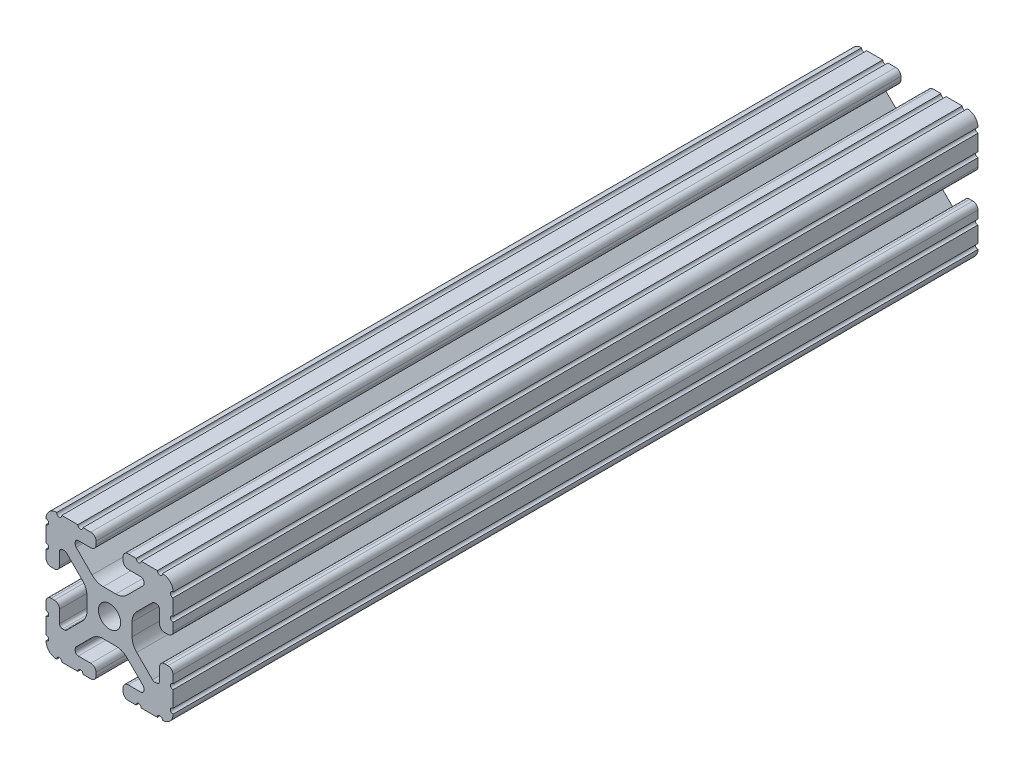
from build123d import *

# Parameters (mm, degrees)
SKETCH1_R      = 3.3274
EXTRUDE1_DEPTH = 241.3


with BuildPart() as part:
    # Sketch1 → Extrude1 (new body)
    with BuildSketch(Plane.XY):
        with BuildLine():
            Line((-10.022898969, 12.91475973), (-5.252158105, 8.144007132))
            ThreePointArc((-5.252158105, 8.144007132), (-3.715177372, 7.117027388), (-1.902183975, 6.7564))
            Line((-1.902183975, 6.7564), (1.902183975, 6.7564))
            ThreePointArc((1.902183975, 6.7564), (3.715177372, 7.117027388), (5.252158105, 8.144007132))
            Line((5.252158105, 8.144007132), (10.022898969, 12.91475973))
            ThreePointArc((10.022898969, 12.91475973), (10.218362387, 13.207291992), (10.287, 13.552357131))
            Line((10.287, 13.552357131), (10.287, 14.0843))
            ThreePointArc((10.287, 14.0843), (10.022898185, 14.721898185), (9.3853, 14.986))
            Line((9.3853, 14.986), (5.617617549, 14.986))
            ThreePointArc((5.617617549, 14.986), (4.519044045, 15.441044045), (4.064, 16.539617549))
            Line((4.064, 16.539617549), (4.064, 17.496382451))
            ThreePointArc((4.064, 17.496382451), (4.519044045, 18.594955955), (5.617617549, 19.05))
            Line((5.617617549, 19.05), (7.974178704, 19.05))
            ThreePointArc((7.974178704, 19.05), (8.736178704, 18.288), (9.498178704, 19.05))
            Line((9.498178704, 19.05), (14.327719207, 19.05))
            ThreePointArc((14.327719207, 19.05), (15.087603123, 18.231251131), (15.847487039, 19.05))
            ThreePointArc((15.847487039, 19.05), (18.120176289, 18.120192083), (19.05, 15.847509295))
            ThreePointArc((19.05, 15.847509295), (18.231250992, 15.08762539), (19.05, 14.327741484))
            Line((19.05, 14.327741484), (19.05, 9.496091471))
            ThreePointArc((19.05, 9.496091471), (18.231250992, 8.736207565), (19.05, 7.97632366))
            Line((19.05, 7.97632366), (19.05, 5.617617549))
            ThreePointArc((19.05, 5.617617549), (18.594955955, 4.519044045), (17.496382451, 4.064))
            Line((17.496382451, 4.064), (16.539617549, 4.064))
            ThreePointArc((16.539617549, 4.064), (15.441044045, 4.519044045), (14.986, 5.617617549))
            Line((14.986, 5.617617549), (14.986, 9.385342516))
            ThreePointArc((14.986, 9.385342516), (14.721898185, 10.022940701), (14.0843, 10.287042516))
            Line((14.0843, 10.287042516), (13.516042086, 10.287042516))
            ThreePointArc((13.516042086, 10.287042516), (13.170975923, 10.218404478), (12.878443117, 10.022939917))
            Line((12.878443117, 10.022939917), (8.14758008, 5.292065243))
            ThreePointArc((8.14758008, 5.292065243), (7.117955879, 3.751120653), (6.7564, 1.933453584))
            Line((6.7564, 1.933453584), (6.7564, -1.933453584))
            ThreePointArc((6.7564, -1.933453584), (7.117955879, -3.751120653), (8.14758008, -5.292065243))
            Line((8.14758008, -5.292065243), (12.878443117, -10.022939917))
            ThreePointArc((12.878443117, -10.022939917), (13.170975923, -10.218404478), (13.516042086, -10.287042516))
            Line((13.516042086, -10.287042516), (14.0843, -10.287042516))
            ThreePointArc((14.0843, -10.287042516), (14.721898185, -10.022940701), (14.986, -9.385342516))
            Line((14.986, -9.385342516), (14.986, -5.617617549))
            ThreePointArc((14.986, -5.617617549), (15.441044045, -4.519044045), (16.539617549, -4.064))
            Line((16.539617549, -4.064), (17.496382451, -4.064))
            ThreePointArc((17.496382451, -4.064), (18.594955955, -4.519044045), (19.05, -5.617617549))
            Line((19.05, -5.617617549), (19.05, -7.976318491))
            ThreePointArc((19.05, -7.976318491), (18.231250992, -8.736202396), (19.05, -9.496086302))
            Line((19.05, -9.496086302), (19.05, -14.32774291))
            ThreePointArc((19.05, -14.32774291), (18.231250992, -15.087626816), (19.05, -15.847510721))
            ThreePointArc((19.05, -15.847510721), (18.120175716, -18.120192644), (15.847486868, -19.05))
            ThreePointArc((15.847486868, -19.05), (15.087602952, -18.231251131), (14.327719036, -19.05))
            Line((14.327719036, -19.05), (9.496062448, -19.05))
            ThreePointArc((9.496062448, -19.05), (8.736178532, -18.231251131), (7.976294616, -19.05))
            Line((7.976294616, -19.05), (5.617617549, -19.05))
            ThreePointArc((5.617617549, -19.05), (4.519044045, -18.594955955), (4.064, -17.496382451))
            Line((4.064, -17.496382451), (4.064, -16.539617549))
            ThreePointArc((4.064, -16.539617549), (4.519044045, -15.441044045), (5.617617549, -14.986))
            Line((5.617617549, -14.986), (9.3853, -14.986))
            ThreePointArc((9.3853, -14.986), (10.022898185, -14.721898185), (10.287, -14.0843))
            Line((10.287, -14.0843), (10.287, -13.552357131))
            ThreePointArc((10.287, -13.552357131), (10.218362387, -13.207291992), (10.022898969, -12.91475973))
            Line((10.022898969, -12.91475973), (5.252158105, -8.144007132))
            ThreePointArc((5.252158105, -8.144007132), (3.715177372, -7.117027388), (1.902183975, -6.7564))
            Line((1.902183975, -6.7564), (-1.902183975, -6.7564))
            ThreePointArc((-1.902183975, -6.7564), (-3.715177372, -7.117027388), (-5.252158105, -8.144007132))
            Line((-5.252158105, -8.144007132), (-10.022898969, -12.91475973))
            ThreePointArc((-10.022898969, -12.91475973), (-10.218362387, -13.207291992), (-10.287, -13.552357131))
            Line((-10.287, -13.552357131), (-10.287, -14.0843))
            ThreePointArc((-10.287, -14.0843), (-10.022898185, -14.721898185), (-9.3853, -14.986))
            Line((-9.3853, -14.986), (-5.617617549, -14.986))
            ThreePointArc((-5.617617549, -14.986), (-4.519044045, -15.441044045), (-4.064, -16.539617549))
            Line((-4.064, -16.539617549), (-4.064, -17.496382451))
            ThreePointArc((-4.064, -17.496382451), (-4.519044045, -18.594955955), (-5.617617549, -19.05))
            Line((-5.617617549, -19.05), (-7.976294616, -19.05))
            ThreePointArc((-7.976294616, -19.05), (-8.736178532, -18.231251131), (-9.496062448, -19.05))
            Line((-9.496062448, -19.05), (-14.327719036, -19.05))
            ThreePointArc((-14.327719036, -19.05), (-15.087602952, -18.231251131), (-15.847486868, -19.05))
            ThreePointArc((-15.847486868, -19.05), (-18.120175716, -18.120192644), (-19.05, -15.847510721))
            ThreePointArc((-19.05, -15.847510721), (-18.231250992, -15.087626816), (-19.05, -14.32774291))
            Line((-19.05, -14.32774291), (-19.05, -9.496086302))
            ThreePointArc((-19.05, -9.496086302), (-18.231250992, -8.736202396), (-19.05, -7.976318491))
            Line((-19.05, -7.976318491), (-19.05, -5.617617549))
            ThreePointArc((-19.05, -5.617617549), (-18.594955955, -4.519044045), (-17.496382451, -4.064))
            Line((-17.496382451, -4.064), (-16.539617549, -4.064))
            ThreePointArc((-16.539617549, -4.064), (-15.441044045, -4.519044045), (-14.986, -5.617617549))
            Line((-14.986, -5.617617549), (-14.986, -9.385342516))
            ThreePointArc((-14.986, -9.385342516), (-14.721898185, -10.022940701), (-14.0843, -10.287042516))
            Line((-14.0843, -10.287042516), (-13.516042086, -10.287042516))
            ThreePointArc((-13.516042086, -10.287042516), (-13.170975923, -10.218404478), (-12.878443117, -10.022939917))
            Line((-12.878443117, -10.022939917), (-8.14758008, -5.292065243))
            ThreePointArc((-8.14758008, -5.292065243), (-7.117955879, -3.751120653), (-6.7564, -1.933453584))
            Line((-6.7564, -1.933453584), (-6.7564, 1.933453584))
            ThreePointArc((-6.7564, 1.933453584), (-7.117955879, 3.751120653), (-8.14758008, 5.292065243))
            Line((-8.14758008, 5.292065243), (-12.878443117, 10.022939917))
            ThreePointArc((-12.878443117, 10.022939917), (-13.170975923, 10.218404478), (-13.516042086, 10.287042516))
            Line((-13.516042086, 10.287042516), (-14.0843, 10.287042516))
            ThreePointArc((-14.0843, 10.287042516), (-14.721898185, 10.022940701), (-14.986, 9.385342516))
            Line((-14.986, 9.385342516), (-14.986, 5.617617549))
            ThreePointArc((-14.986, 5.617617549), (-15.441044045, 4.519044045), (-16.539617549, 4.064))
            Line((-16.539617549, 4.064), (-17.496382451, 4.064))
            ThreePointArc((-17.496382451, 4.064), (-18.594955955, 4.519044045), (-19.05, 5.617617549))
            Line((-19.05, 5.617617549), (-19.05, 7.97632366))
            ThreePointArc((-19.05, 7.97632366), (-18.231250992, 8.736207565), (-19.05, 9.496091471))
            Line((-19.05, 9.496091471), (-19.05, 14.327741484))
            ThreePointArc((-19.05, 14.327741484), (-18.231250992, 15.08762539), (-19.05, 15.847509295))
            ThreePointArc((-19.05, 15.847509295), (-18.120176289, 18.120192083), (-15.847487039, 19.05))
            ThreePointArc((-15.847487039, 19.05), (-15.087603123, 18.231251131), (-14.327719207, 19.05))
            Line((-14.327719207, 19.05), (-9.498178704, 19.05))
            ThreePointArc((-9.498178704, 19.05), (-8.736178704, 18.288), (-7.974178704, 19.05))
            Line((-7.974178704, 19.05), (-5.617617549, 19.05))
            ThreePointArc((-5.617617549, 19.05), (-4.519044045, 18.594955955), (-4.064, 17.496382451))
            Line((-4.064, 17.496382451), (-4.064, 16.539617549))
            ThreePointArc((-4.064, 16.539617549), (-4.519044045, 15.441044045), (-5.617617549, 14.986))
            Line((-5.617617549, 14.986), (-9.3853, 14.986))
            ThreePointArc((-9.3853, 14.986), (-10.022898185, 14.721898185), (-10.287, 14.0843))
            Line((-10.287, 14.0843), (-10.287, 13.552357131))
            ThreePointArc((-10.287, 13.552357131), (-10.218362387, 13.207291992), (-10.022898969, 12.91475973))
        make_face()
        Circle(SKETCH1_R, mode=Mode.SUBTRACT)
    extrude(amount=-EXTRUDE1_DEPTH)


solid = part.part
